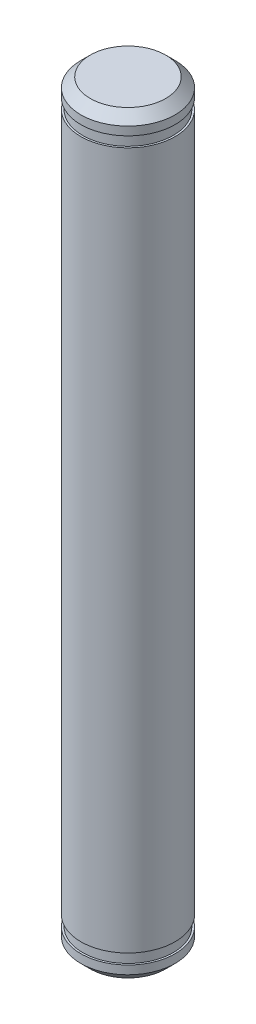
from build123d import *

# Parameters (mm, degrees)
CHAMFER_1_SIZE      = 1
CUT_EXTRUDE_START   = -3
SKETCH_2_R          = 5
SKETCH_2_R_2        = 4.8
CUT_EXTRUDE_1_DEPTH = 1.1


with BuildPart() as part:
    # 草图1 → 旋转1 (revolve)
    with BuildSketch(Plane.XY, mode=Mode.PRIVATE) as revolve_1_sk:
        Polygon((0, 40), (5, 40), (5, 30), (5, -30), (5, -40), (0, -40), align=None)
    revolve(revolve_1_sk.sketch.rotate(Axis((0, 40, 0), (0, -1, 0)), 180), axis=Axis((0, 40, 0), (0, -1, 0)))

    # 倒角1
    chamfer_1_edges = [part.edges().sort_by_distance(p)[0] for p in [
        (5, -40, 0),
        (5, 40, 0),
    ]]
    chamfer(chamfer_1_edges, length=CHAMFER_1_SIZE)

    # 草图2 → 切除-拉伸1 (cut)
    with BuildSketch(Plane(origin=(0, 40, 0), x_dir=(1, 0, 0), z_dir=(0, 1, 0)).offset(CUT_EXTRUDE_START)):
        with Locations(Location((0, 0, 0), (0, 0, 180))):
            Circle(SKETCH_2_R)
        with Locations(Location((0, 0, 0), (0, 0, 180))):
            Circle(SKETCH_2_R_2, mode=Mode.SUBTRACT)
    cut_extrude_1 = extrude(amount=CUT_EXTRUDE_1_DEPTH, mode=Mode.SUBTRACT)

    # 镜向1: 切除-拉伸1 across plane
    add(cut_extrude_1.mirror(Plane.ZX), mode=Mode.SUBTRACT)


solid = part.part
